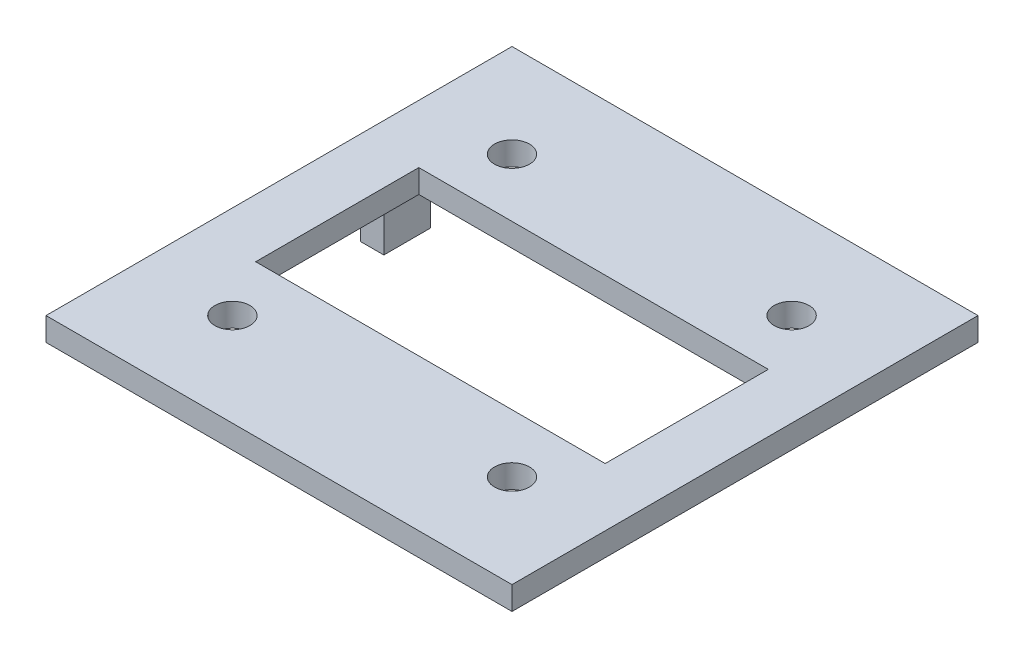
from build123d import *

# Parameters (mm, degrees)
SKETCH2_W           = 40
SKETCH2_H           = 40
SKETCH2_R           = 1.5
SKETCH2_W_2         = 30
SKETCH2_H_2         = 14.001199324
BOSS_EXTRUDE1_DEPTH = 2
SKETCH3_W           = 2
SKETCH3_H           = 4
BOSS_EXTRUDE2_DEPTH = 6


with BuildPart() as part:
    # Sketch2 → Boss-Extrude1 (new body)
    with BuildSketch(Plane(origin=(0, 0, 0), x_dir=(1, 0, 0), z_dir=(0, 1, 0))):
        Rectangle(SKETCH2_W, SKETCH2_H)
        with Locations(Location((-12, 12, 0), (0, 0, 270))):
            Circle(SKETCH2_R, mode=Mode.SUBTRACT)
        with Locations(Location((12, 12, 0), (0, 0, 270))):
            Circle(SKETCH2_R, mode=Mode.SUBTRACT)
        with Locations(Location((-12, -12, 0), (0, 0, 270))):
            Circle(SKETCH2_R, mode=Mode.SUBTRACT)
        with Locations(Location((12, -12, 0), (0, 0, 270))):
            Circle(SKETCH2_R, mode=Mode.SUBTRACT)
        Rectangle(SKETCH2_W_2, SKETCH2_H_2, mode=Mode.SUBTRACT)
    extrude(amount=BOSS_EXTRUDE1_DEPTH)

    # Sketch3 → Boss-Extrude2 (add)
    with BuildSketch(Plane.XZ):
        with Locations((-19, 9)):
            Rectangle(SKETCH3_W, SKETCH3_H)
        with Locations((-19, -9)):
            Rectangle(SKETCH3_W, SKETCH3_H)
    extrude(amount=BOSS_EXTRUDE2_DEPTH)


solid = part.part
